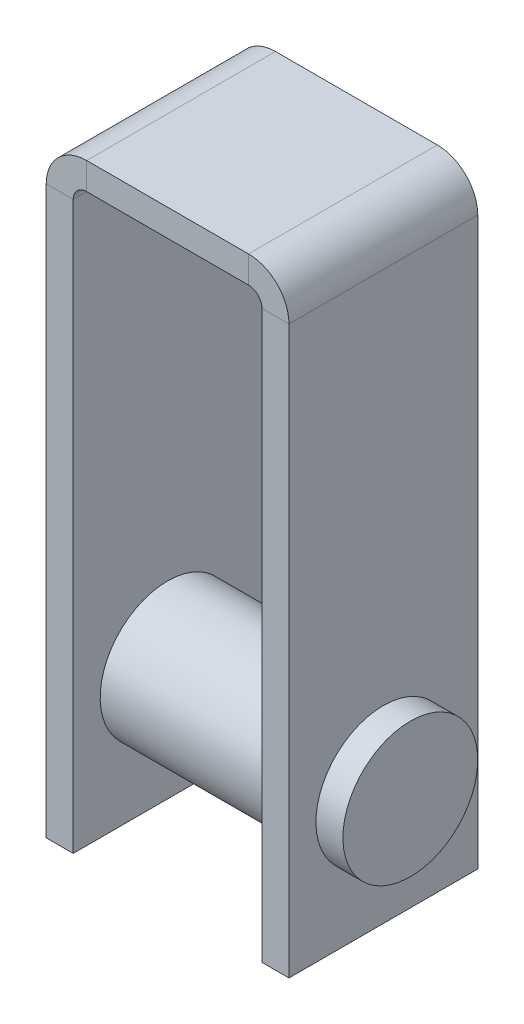
from build123d import *

# Parameters (mm, degrees)
SKETCH2_W                = 70
SKETCH2_H                = 10
SKETCH3_R                = 25
CUT_EXTRUDE1_DEPTH       = 241.260275535
BOSS_EXTRUDE1_DEPTH      = 10
BOSS_EXTRUDE1_DEPTH_BACK = 100
SKETCH4_R                = 25


with BuildPart() as part:
    # Sweep1: sweep along a path in Sketch1
    with BuildLine(Plane.XY) as sweep1_path:
        Line((48.354821102, -220), (48.354821102, -10))
        ThreePointArc((48.354821102, -10), (45.425888913, -2.928932188), (38.354821102, 0))
        Line((38.354821102, 0), (-21.645178898, 0))
        ThreePointArc((-21.645178898, 0), (-28.71624671, -2.928932188), (-31.645178898, -10))
        Line((-31.645178898, -10), (-31.645178898, -220))
    # Sketch2 → Sweep1 (sweep)
    with BuildSketch(Plane(origin=(0, 0, 0), x_dir=(0, 0, -1), z_dir=(1, 0, 0))):
        Rectangle(SKETCH2_W, SKETCH2_H)
    sweep(path=sweep1_path.line)

    # Sketch3 → Cut-Extrude1 (cut, through all)
    with BuildSketch(Plane(origin=(53.354821102, 0, 0), x_dir=(0, 0, -1), z_dir=(1, 0, 0))):
        with Locations(Location((0, -175, 0), (0, 0, 90))):
            Circle(SKETCH3_R)
    extrude(amount=-CUT_EXTRUDE1_DEPTH, mode=Mode.SUBTRACT)

    # Sketch4 → Boss-Extrude1 (add, two sides: drawn at the far end of the back side and taken through both)
    with BuildSketch(Plane(origin=(53.354821102, 0, 0), x_dir=(0, 0, -1), z_dir=(1, 0, 0)).offset(-BOSS_EXTRUDE1_DEPTH_BACK)):
        with Locations(Location((0, -175, 0), (0, 0, 90))):
            Circle(SKETCH4_R)
    extrude(amount=BOSS_EXTRUDE1_DEPTH + BOSS_EXTRUDE1_DEPTH_BACK)


solid = part.part
